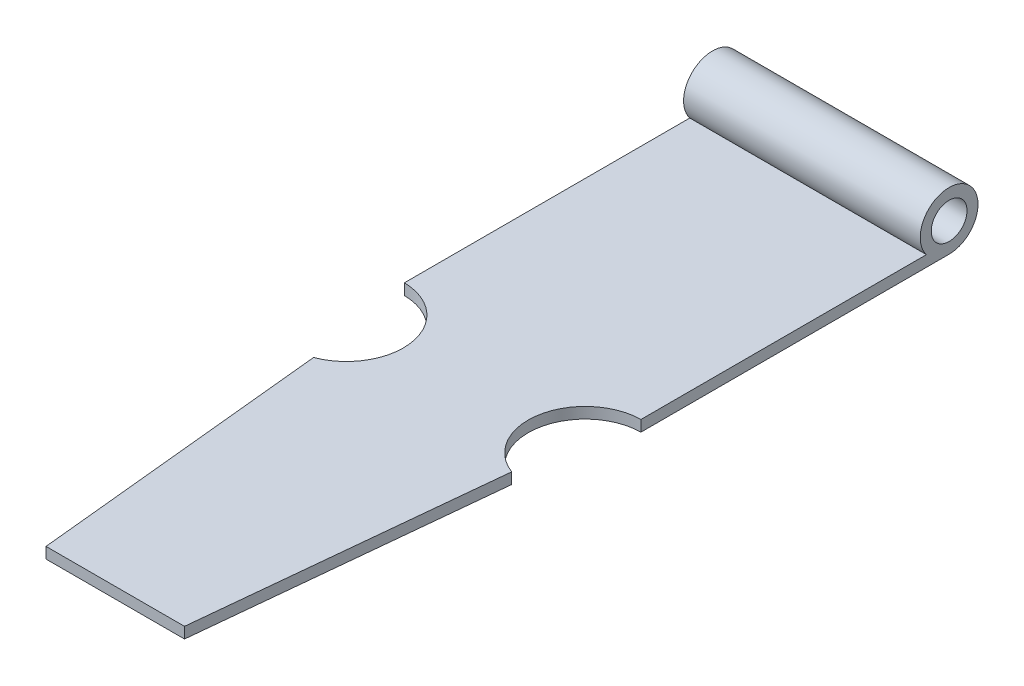
from build123d import *

# Parameters (mm, degrees)
EXTRUDE_1_DEPTH = 2
SKETCH_4_R      = 5.25
SKETCH_4_R_2    = 3.25
EXTRUDE_4_DEPTH = 42.99


with BuildPart() as part:
    # Эскиз1 → Бобышка-Вытянуть1 (new body)
    with BuildSketch(Plane(origin=(0, 0, 0), x_dir=(1, 0, 0), z_dir=(0, 1, 0))):
        with BuildLine():
            Line((-21.495, 0), (21.495, 0))
            Line((21.495, 0), (21.495, -55.974685573))
            ThreePointArc((21.495, -55.974685573), (11.495, -64.530824352), (17.994657773, -75.974685573))
            Line((17.994657773, -75.974685573), (12.58, -130))
            Line((12.58, -130), (-12.58, -130))
            Line((-12.58, -130), (-17.994657773, -75.974685573))
            ThreePointArc((-17.994657773, -75.974685573), (-11.495, -64.530824352), (-21.495, -55.974685573))
            Line((-21.495, -55.974685573), (-21.495, 0))
        make_face()
    extrude(amount=EXTRUDE_1_DEPTH)

    # Эскиз4 → Бобышка-Вытянуть4 (add)
    with BuildSketch(Plane(origin=(21.495, 0, 0.569378428), x_dir=(0, 0, -1), z_dir=(1, 0, 0))):
        with Locations((0.569378428, 5.25)):
            Circle(SKETCH_4_R)
        with Locations((0.569378428, 5.25)):
            Circle(SKETCH_4_R_2, mode=Mode.SUBTRACT)
    extrude(amount=-EXTRUDE_4_DEPTH)


solid = part.part
